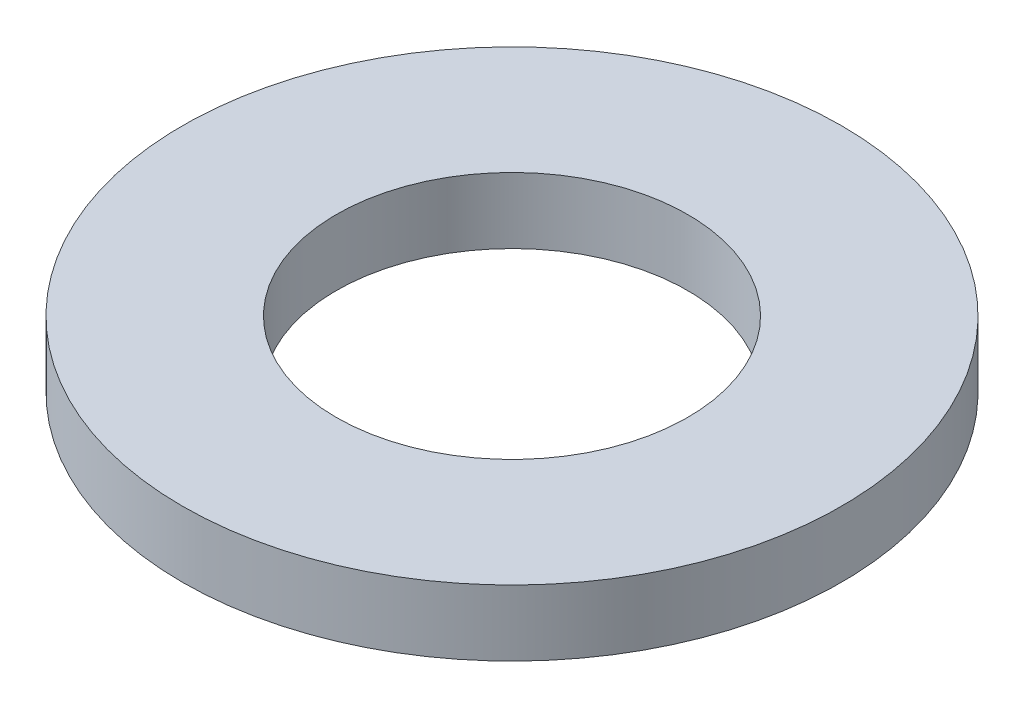
from build123d import *

# Parameters (mm, degrees)
IZIM1_R                     = 7.5
IZIM1_R_2                   = 4
Y_KSEKLIK_EKSTR_ZYON1_DEPTH = 1.5


with BuildPart() as part:
    # Çizim1 → Yükseklik-Ekstrüzyon1 (new body)
    with BuildSketch(Plane(origin=(0, 0, 0), x_dir=(1, 0, 0), z_dir=(0, 1, 0))):
        with Locations(Location((0, 0, 0), (0, 0, 270))):
            Circle(IZIM1_R)
        with Locations(Location((0, 0, 0), (0, 0, 270))):
            Circle(IZIM1_R_2, mode=Mode.SUBTRACT)
    extrude(amount=Y_KSEKLIK_EKSTR_ZYON1_DEPTH)


solid = part.part
